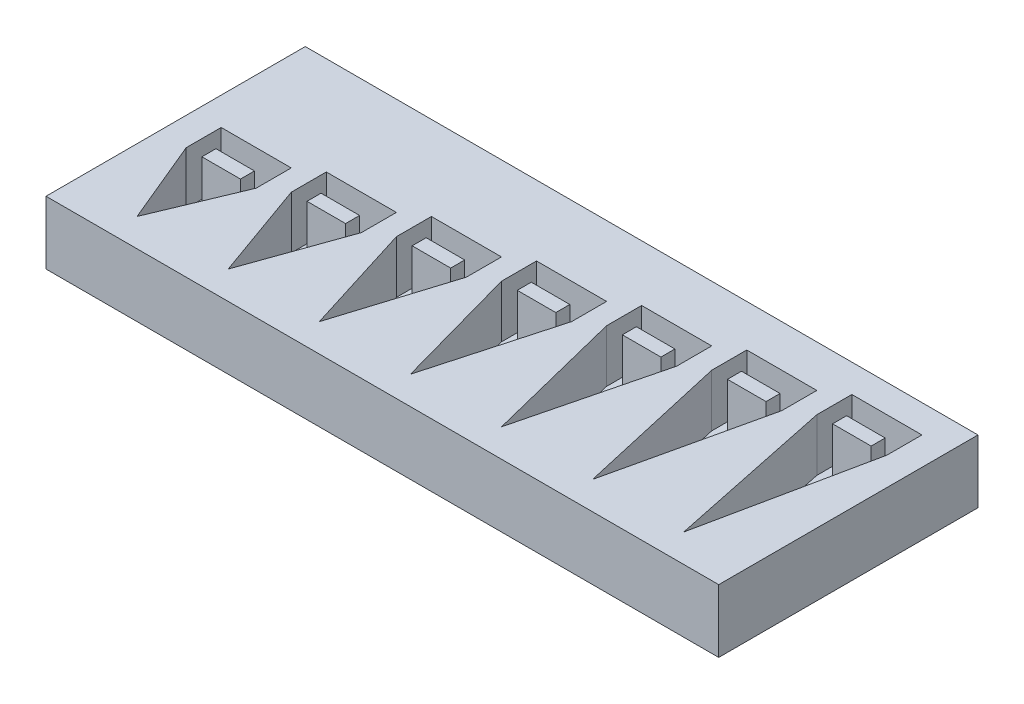
from build123d import *

# Parameters (mm, degrees)
FLAPS_W               = 96
FLAPS_H               = 37
BOSS_EXTRUDE1_DEPTH   = 7.5
FLAPS_W_2             = 5.5
FLAPS_H_2             = 2
BOSS_EXTRUDE1_2_DEPTH = 7.5
BOSS_EXTRUDE1_3_DEPTH = 7.5
BOSS_EXTRUDE1_4_DEPTH = 7.5
BOSS_EXTRUDE1_5_DEPTH = 7.5
BOSS_EXTRUDE1_6_DEPTH = 7.5
BOSS_EXTRUDE1_7_DEPTH = 7.5
BOSS_EXTRUDE1_8_DEPTH = 7.5
SKETCH2_W             = 96
SKETCH2_H             = 37
BOSS_EXTRUDE2_DEPTH   = 1.5


with BuildPart() as part:
    # Flaps → Boss-Extrude1 (new body)
    with BuildSketch(Plane(origin=(0, 0, 0), x_dir=(1, 0, 0), z_dir=(0, 1, 0))):
        with Locations((39, 14.5)):
            Rectangle(FLAPS_W, FLAPS_H)
        Polygon((78, 0), (83, 24), (83, 29), (73, 29), (73, 24), align=None, mode=Mode.SUBTRACT)
        Polygon((65, 0), (70, 22), (70, 27), (60, 27), (60, 22), align=None, mode=Mode.SUBTRACT)
        Polygon((52, 0), (57, 20), (57, 25), (47, 25), (47, 20), align=None, mode=Mode.SUBTRACT)
        Polygon((39, 0), (44, 18), (44, 23), (34, 23), (34, 18), align=None, mode=Mode.SUBTRACT)
        Polygon((26, 0), (31, 16), (31, 21), (21, 21), (21, 16), align=None, mode=Mode.SUBTRACT)
        Polygon((13, 0), (18, 14), (18, 19), (8, 19), (8, 14), align=None, mode=Mode.SUBTRACT)
        Polygon((0, 0), (5, 12), (5, 17), (-5, 17), (-5, 12), align=None, mode=Mode.SUBTRACT)
    extrude(amount=BOSS_EXTRUDE1_DEPTH)



with BuildPart() as body_2:
    # Flaps → Boss-Extrude1 2 (new body)
    with BuildSketch(Plane(origin=(0, 0, 0), x_dir=(1, 0, 0), z_dir=(0, 1, 0))):
        with Locations((0, 13)):
            Rectangle(FLAPS_W_2, FLAPS_H_2)
    extrude(amount=BOSS_EXTRUDE1_2_DEPTH)


with BuildPart() as body_3:
    # Flaps → Boss-Extrude1 3 (new body)
    with BuildSketch(Plane(origin=(0, 0, 0), x_dir=(1, 0, 0), z_dir=(0, 1, 0))):
        with Locations((13, 15)):
            Rectangle(FLAPS_W_2, FLAPS_H_2)
    extrude(amount=BOSS_EXTRUDE1_3_DEPTH)


with BuildPart() as body_4:
    # Flaps → Boss-Extrude1 4 (new body)
    with BuildSketch(Plane(origin=(0, 0, 0), x_dir=(1, 0, 0), z_dir=(0, 1, 0))):
        with Locations((26, 17)):
            Rectangle(FLAPS_W_2, FLAPS_H_2)
    extrude(amount=BOSS_EXTRUDE1_4_DEPTH)


with BuildPart() as body_5:
    # Flaps → Boss-Extrude1 5 (new body)
    with BuildSketch(Plane(origin=(0, 0, 0), x_dir=(1, 0, 0), z_dir=(0, 1, 0))):
        with Locations((39, 19)):
            Rectangle(FLAPS_W_2, FLAPS_H_2)
    extrude(amount=BOSS_EXTRUDE1_5_DEPTH)


with BuildPart() as body_6:
    # Flaps → Boss-Extrude1 6 (new body)
    with BuildSketch(Plane(origin=(0, 0, 0), x_dir=(1, 0, 0), z_dir=(0, 1, 0))):
        with Locations((52, 21)):
            Rectangle(FLAPS_W_2, FLAPS_H_2)
    extrude(amount=BOSS_EXTRUDE1_6_DEPTH)


with BuildPart() as body_7:
    # Flaps → Boss-Extrude1 7 (new body)
    with BuildSketch(Plane(origin=(0, 0, 0), x_dir=(1, 0, 0), z_dir=(0, 1, 0))):
        with Locations((65, 23)):
            Rectangle(FLAPS_W_2, FLAPS_H_2)
    extrude(amount=BOSS_EXTRUDE1_7_DEPTH)


with BuildPart() as body_8:
    # Flaps → Boss-Extrude1 8 (new body)
    with BuildSketch(Plane(origin=(0, 0, 0), x_dir=(1, 0, 0), z_dir=(0, 1, 0))):
        with Locations((78, 25)):
            Rectangle(FLAPS_W_2, FLAPS_H_2)
    extrude(amount=BOSS_EXTRUDE1_8_DEPTH)


with BuildPart() as part_1:
    add(part.part)

    add(body_2.part)  # Boss-Extrude2 merges body 2

    add(body_3.part)  # Boss-Extrude2 merges body 3

    add(body_4.part)  # Boss-Extrude2 merges body 4

    add(body_5.part)  # Boss-Extrude2 merges body 5

    add(body_6.part)  # Boss-Extrude2 merges body 6

    add(body_7.part)  # Boss-Extrude2 merges body 7

    add(body_8.part)  # Boss-Extrude2 merges body 8
    # Sketch2 → Boss-Extrude2 (add)
    with BuildSketch(Plane.XZ):
        with Locations((39, -14.5)):
            Rectangle(SKETCH2_W, SKETCH2_H)
    extrude(amount=BOSS_EXTRUDE2_DEPTH)


solid = part_1.part
